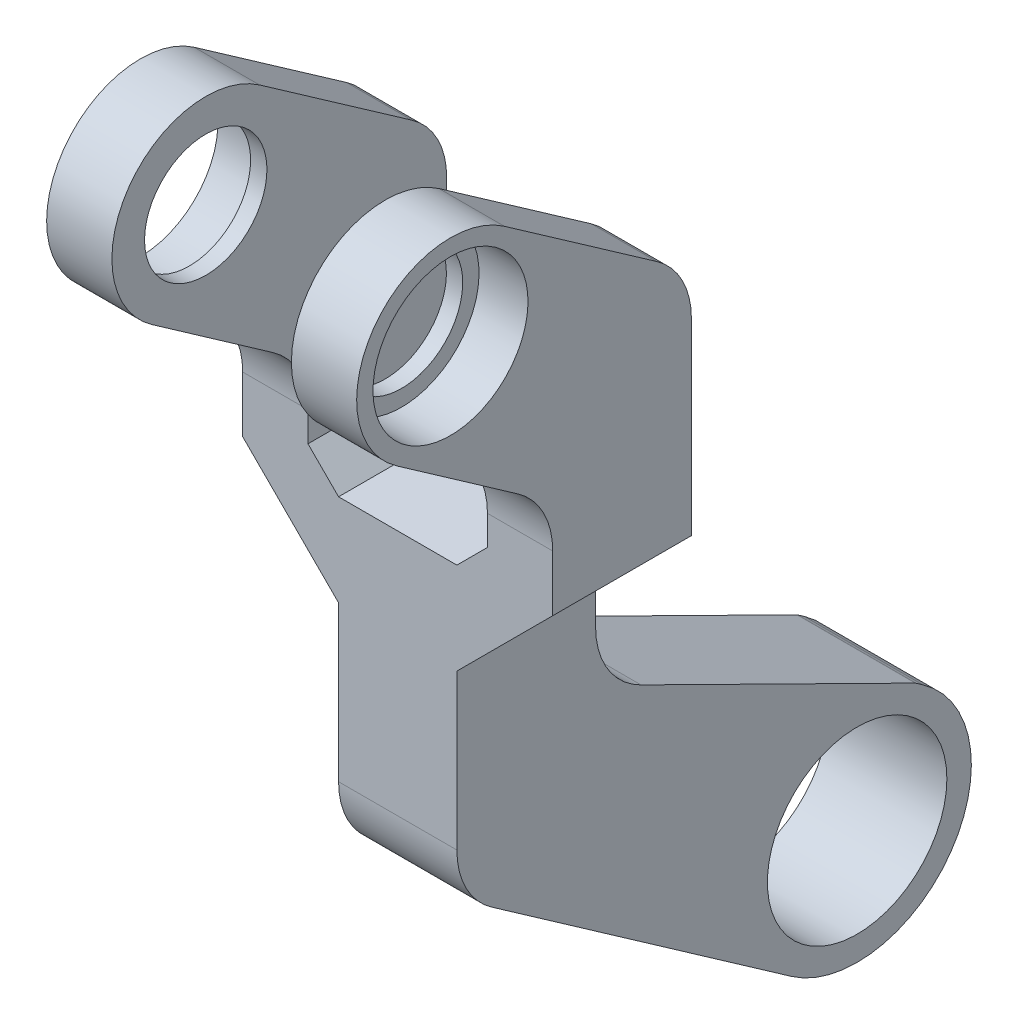
from build123d import *

# Parameters (mm, degrees)
EXTRUDE_1_DEPTH      = 23
CUT_EXTRUDE_1_DEPTH  = 70.412264766
EXTRUDE_7_REACH      = 76.653
EXTRUDE_8_DEPTH      = 38
SKETCH_18_R          = 7.5
CUT_EXTRUDE_10_DEPTH = 97.091099475
SKETCH_16_W          = 22
SKETCH_16_H          = 105.274199252
CUT_EXTRUDE_9_DEPTH  = 60.342228518
EXTRUDE_5_DEPTH      = 14.5
EXTRUDE_6_DEPTH      = 14.5
SKETCH_14_R          = 11
CUT_EXTRUDE_8_DEPTH  = 14.5
SKETCH_19_R          = 9.5
CUT_EXTRUDE_11_DEPTH = 6
CUT_EXTRUDE_START    = -6
SKETCH_20_R          = 9.5
CUT_EXTRUDE_12_DEPTH = 6
CUT_EXTRUDE_13_DEPTH = 42
CUT_EXTRUDE_14_DEPTH = 42
FILLET_1_R           = 10


with BuildPart() as part:
    # 草图1 → 凸台-拉伸1 (new body)
    with BuildSketch(Plane.XY):
        Polygon((0, 0), (14.5, 0), (14.5, 20), (26.25, 31.75), (26.25, 60), (18.25, 60), (18.25, 35), (-3.75, 35), (-3.75, 60), (-11.75, 60), (-11.75, 31.75), (0, 20), align=None)
    extrude(amount=EXTRUDE_1_DEPTH)

    # 草图2 → 切除-拉伸1 (cut, through all)
    with BuildSketch(Plane.XY.offset(23)):
        Polygon((-3.75, 35), (0, 31.25), (14.5, 31.25), (18.25, 35), align=None)
    extrude(amount=-CUT_EXTRUDE_1_DEPTH, mode=Mode.SUBTRACT)

    # 凸台-拉伸7: up to this face of the body (flat: up to its plane)
    extrude_7_end = Plane(part.part.faces().sort_by_distance((-11.75, 45.875, 11.5))[0])
    # 草图15 → 凸台-拉伸7 (add, up to the picked face)
    with BuildSketch(Plane(origin=(26.25, 0, 0), x_dir=(0, 0, -1), z_dir=(1, 0, 0)), mode=Mode.PRIVATE) as extrude_7_sk1:
        Polygon((0, 60), (-22.93625724, 76.060140218), (-36.128515276, 57.219643199), (-23, 48.026957837), align=None)
    extrude_7_tool1 = split(extrude(extrude_7_sk1.sketch, amount=-EXTRUDE_7_REACH, mode=Mode.PRIVATE), bisect_by=extrude_7_end, keep=Keep.BOTH, mode=Mode.PRIVATE)
    add(extrude_7_tool1.solids().sort_by(Axis((26.25, 61.024992, 19.695992), (-1, 0, 0)))[0])

    # 草图17 → 凸台-拉伸8 (add)
    with BuildSketch(Plane(origin=(26.25, 0, 0), x_dir=(0, 0, -1), z_dir=(1, 0, 0))):
        with BuildLine():
            Line((-22.93625724, 76.060140218), (-36.128515276, 57.219643199))
            ThreePointArc((-36.128515276, 57.219643199), (-38.952634767, 73.236020727), (-22.93625724, 76.060140218))
        make_face()
    extrude(amount=-EXTRUDE_8_DEPTH)

    # 草图18 → 切除-拉伸10 (cut, through all)
    with BuildSketch(Plane(origin=(26.25, 0, 0), x_dir=(0, 0, -1), z_dir=(1, 0, 0))):
        with Locations(Location((-29.532386258, 66.639891709, 0), (0, 0, 90))):
            Circle(SKETCH_18_R)
    extrude(amount=-CUT_EXTRUDE_10_DEPTH, mode=Mode.SUBTRACT)

    # 草图16 → 切除-拉伸9 (cut, through all)
    with BuildSketch(Plane(origin=(0, 47.207293091, 24.574561329), x_dir=(1, 0, 0), z_dir=(0, -0.8870108331782229, -0.4617486132350318))):
        with Locations((7.25, 24.932182832)):
            Rectangle(SKETCH_16_W, SKETCH_16_H)
    extrude(amount=-CUT_EXTRUDE_9_DEPTH, mode=Mode.SUBTRACT)

    # 草图12 → 凸台-拉伸5 (add)
    with BuildSketch(Plane(origin=(14.5, 0, 0), x_dir=(0, 0, -1), z_dir=(1, 0, 0))):
        Polygon((0, 18.076915106), (40.09243026, -9.996106787), (24.032290042, -32.932364027), (-23, 0), align=None)
    extrude(amount=-EXTRUDE_5_DEPTH)

    # 草图13 → 凸台-拉伸6 (add)
    with BuildSketch(Plane(origin=(14.5, 0, 0), x_dir=(0, 0, -1), z_dir=(1, 0, 0))):
        with BuildLine():
            Line((40.09243026, -9.996106787), (24.032290042, -32.932364027))
            ThreePointArc((24.032290042, -32.932364027), (43.530488771, -29.494305516), (40.09243026, -9.996106787))
        make_face()
    extrude(amount=-EXTRUDE_6_DEPTH)

    # 草图14 → 切除-拉伸8 (cut)
    with BuildSketch(Plane(origin=(14.5, 0, 0), x_dir=(0, 0, -1), z_dir=(1, 0, 0))):
        with Locations((32.062360151, -21.464235407)):
            Circle(SKETCH_14_R)
    extrude(amount=-CUT_EXTRUDE_8_DEPTH, mode=Mode.SUBTRACT)

    # 草图19 → 切除-拉伸11 (cut)
    with BuildSketch(Plane(origin=(26.25, 0, 0), x_dir=(0, 0, -1), z_dir=(1, 0, 0))):
        with Locations(Location((-29.532386258, 66.639891709, 0), (0, 0, 90))):
            Circle(SKETCH_19_R)
    extrude(amount=-CUT_EXTRUDE_11_DEPTH, mode=Mode.SUBTRACT)

    # 草图20 → 切除-拉伸12 (cut)
    with BuildSketch(Plane.ZY.offset(11.75).offset(CUT_EXTRUDE_START)):
        with Locations(Location((29.532386258, 66.639891709, 0), (0, 0, 90))):
            Circle(SKETCH_20_R)
    extrude(amount=CUT_EXTRUDE_12_DEPTH, mode=Mode.SUBTRACT)

    # 草图21 → 切除-拉伸13 (cut)
    with BuildSketch(Plane(origin=(26.25, 0, 0), x_dir=(0, 0, -1), z_dir=(1, 0, 0))):
        Polygon((-23, 48.026957837), (-17, 43.825712608), (-17, -13.167272348), (-41.854258514, 0), align=None)
    extrude(amount=-CUT_EXTRUDE_13_DEPTH, mode=Mode.SUBTRACT)

    # 草图22 → 切除-拉伸14 (cut)
    with BuildSketch(Plane(origin=(14.5, 0, 0), x_dir=(0, 0, -1), z_dir=(1, 0, 0))):
        with BuildLine():
            Line((0, 18.076915106), (0, 10))
            Line((0, 10), (39.195351346, -9.373093948))
            ThreePointArc((39.195351346, -9.373093948), (42.389326913, -11.954817829), (44.699464232, -15.350409632))
            Line((44.699464232, -15.350409632), (51.638294373, -1.311873193))
            Line((51.638294373, -1.311873193), (0, 18.076915106))
        make_face()
    extrude(amount=-CUT_EXTRUDE_14_DEPTH, mode=Mode.SUBTRACT)

    # 圆角1
    fillet_1_edges = [part.edges().sort_by_distance(p)[0] for p in [
        (-7.75, 60, 0),
        (22.25, 60, 0),
        (7.25, -4.201245229, 17),
        (22.25, 43.825712608, 17),
        (-7.75, 43.825712608, 17),
        (7.25, 10, 0),
    ]]
    fillet(fillet_1_edges, radius=FILLET_1_R)


solid = part.part
